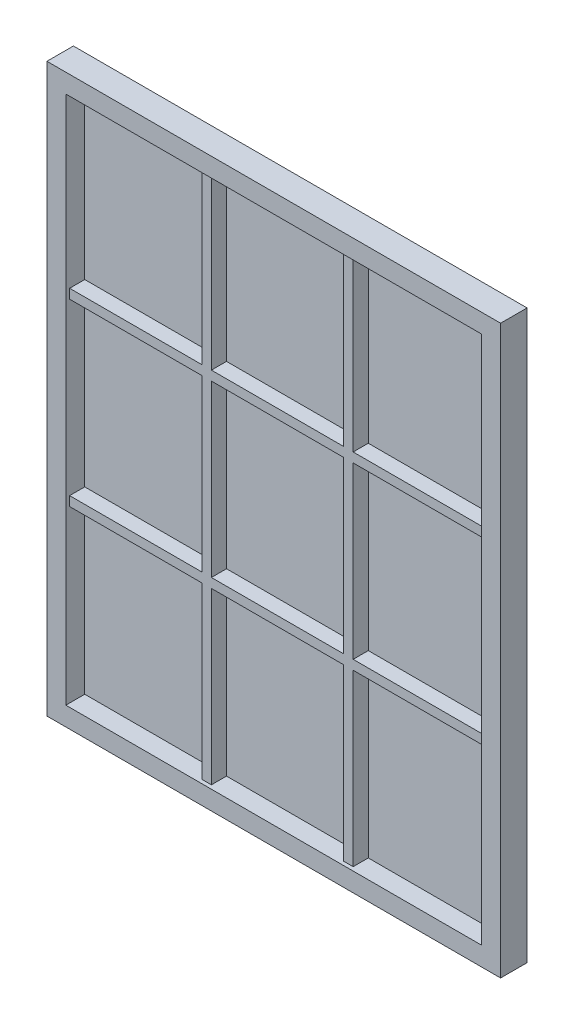
from build123d import *

# Parameters (mm, degrees)
SKETCH1_W           = 304.8
SKETCH1_H           = 381
BOSS_EXTRUDE1_DEPTH = 17.78
SKETCH2_W           = 88.9
SKETCH2_H           = 114.3
CUT_EXTRUDE1_DEPTH  = 12.7
SKETCH3_W           = 279.4
SKETCH3_H           = 355.6
CUT_EXTRUDE2_DEPTH  = 2.54
SKETCH4_R           = 1.27
CUT_EXTRUDE3_DEPTH  = 12.7


with BuildPart() as part:
    # Sketch1 → Boss-Extrude1 (new body)
    with BuildSketch(Plane.XY):
        with Locations((152.4, 190.5)):
            Rectangle(SKETCH1_W, SKETCH1_H)
    extrude(amount=BOSS_EXTRUDE1_DEPTH)

    # Sketch2 → Cut-Extrude1 (cut)
    with BuildSketch(Plane.XY.offset(17.78)):
        with Locations((57.15, 69.85)):
            Rectangle(SKETCH2_W, SKETCH2_H)
        with Locations((152.4, 311.15)):
            Rectangle(SKETCH2_W, SKETCH2_H)
        with Locations((57.15, 311.15)):
            Rectangle(SKETCH2_W, SKETCH2_H)
        with Locations((247.65, 311.15)):
            Rectangle(SKETCH2_W, SKETCH2_H)
        with Locations((57.15, 190.5)):
            Rectangle(SKETCH2_W, SKETCH2_H)
        with Locations((152.4, 190.5)):
            Rectangle(SKETCH2_W, SKETCH2_H)
        with Locations((247.65, 190.5)):
            Rectangle(SKETCH2_W, SKETCH2_H)
        with Locations((152.4, 69.85)):
            Rectangle(SKETCH2_W, SKETCH2_H)
        with Locations((247.65, 69.85)):
            Rectangle(SKETCH2_W, SKETCH2_H)
    extrude(amount=-CUT_EXTRUDE1_DEPTH, mode=Mode.SUBTRACT)

    # Sketch3 → Cut-Extrude2 (cut)
    with BuildSketch(Plane.XY.offset(17.78)):
        with Locations((152.4, 190.5)):
            Rectangle(SKETCH3_W, SKETCH3_H)
    extrude(amount=-CUT_EXTRUDE2_DEPTH, mode=Mode.SUBTRACT)

    # Sketch4 → Cut-Extrude3 (cut)
    with BuildSketch(Plane(origin=(0, 0, 0), x_dir=(-1, 0, 0), z_dir=(0, 0, -1))):
        with Locations((-6.35, 374.65)):
            Circle(SKETCH4_R)
        with Locations((-298.45, 374.65)):
            Circle(SKETCH4_R)
    extrude(amount=-CUT_EXTRUDE3_DEPTH, mode=Mode.SUBTRACT)


solid = part.part
